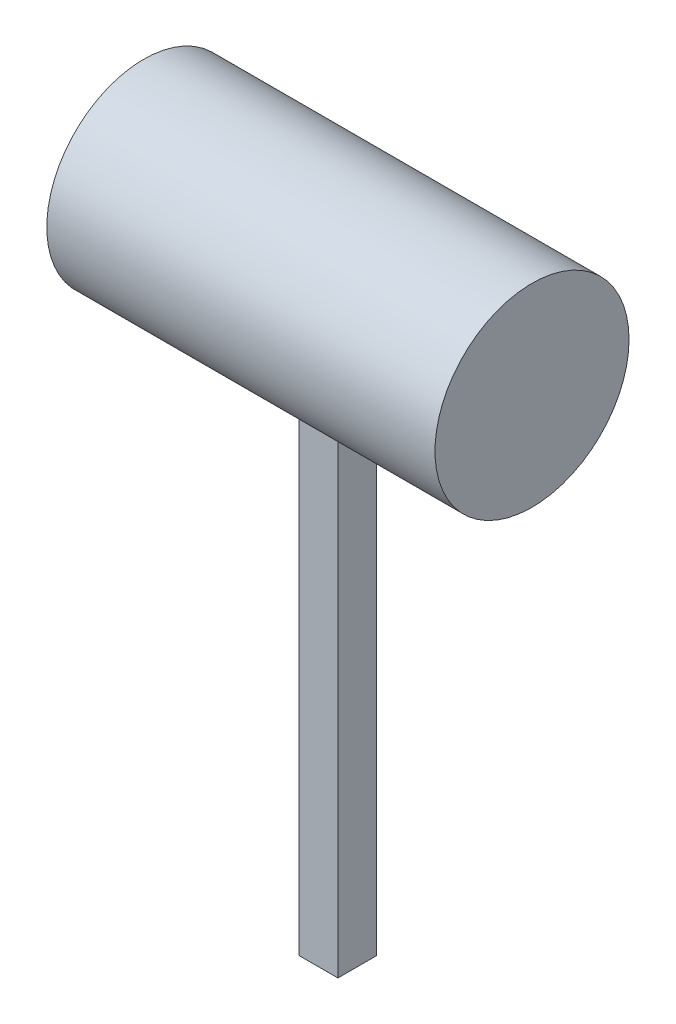
from build123d import *

# Parameters (mm, degrees)
SKETCH1_R           = 5
BOSS_EXTRUDE1_DEPTH = 10
SKETCH2_W           = 2
SKETCH2_H           = 30
BOSS_EXTRUDE2_DEPTH = 1


with BuildPart() as part:
    # Sketch1 → Boss-Extrude1 (new, symmetric)
    with BuildSketch(Plane(origin=(0, 0, 0), x_dir=(0, 0, -1), z_dir=(1, 0, 0))):
        Circle(SKETCH1_R)
    extrude(amount=BOSS_EXTRUDE1_DEPTH, both=True)

    # Sketch2 → Boss-Extrude2 (add, symmetric)
    with BuildSketch(Plane.XY):
        with Locations((0, -15)):
            Rectangle(SKETCH2_W, SKETCH2_H)
    extrude(amount=BOSS_EXTRUDE2_DEPTH, both=True)


solid = part.part
